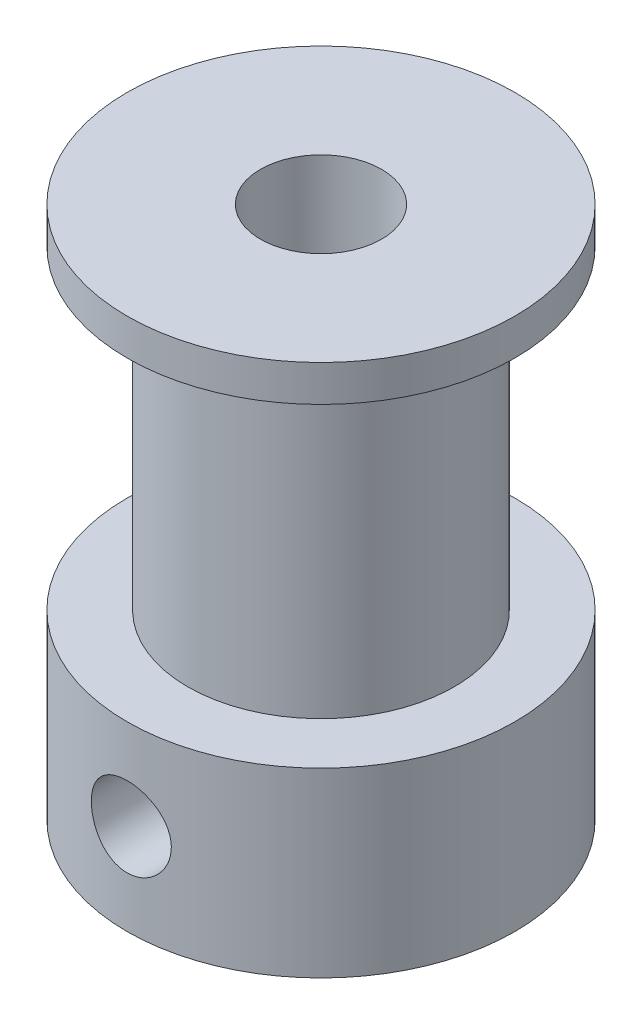
from build123d import *

# Parameters (mm, degrees)
CROQUIS3_W     = 1.65
CROQUIS3_H     = 8.001
MATRIZC1_COUNT = 2
MATRIZC1_ANGLE = 90


with BuildPart() as part:
    # Croquis1 → Revolución1 (revolve)
    with BuildSketch(Plane.XY, mode=Mode.PRIVATE) as revoluci_n1_sk:
        Polygon((8, 7.5), (8, 0), (2.5, 0), (2.5, 22), (8, 22), (8, 20.5), (5.5, 20.5), (5.5, 7.5), align=None)
    revolve(revoluci_n1_sk.sketch.rotate(Axis((0, 0, 0), (0, 1, 0)), 90), axis=Axis((0, 0, 0), (0, 1, 0)))

    # Croquis3 → Taladro roscado M41 (revolve, cut)
    with BuildSketch(Plane(origin=(0, 3.75, 0), x_dir=(0, 1, 0), z_dir=(1, 0, 0))):
        with Locations((0.825, 4.0005)):
            Rectangle(CROQUIS3_W, CROQUIS3_H)
    taladro_roscado_m41 = revolve(axis=Axis((0, 3.75, -6.35), (0, 0, 1)), mode=Mode.SUBTRACT)

    # MatrizC1: Taladro roscado M41 ×2 about axis
    matrizc1_axis = Axis((0, 0, 0), (0, -1, 0))
    for i in range(1, MATRIZC1_COUNT):
        add(taladro_roscado_m41.rotate(matrizc1_axis, i * MATRIZC1_ANGLE / (MATRIZC1_COUNT - 1)), mode=Mode.SUBTRACT)


solid = part.part
